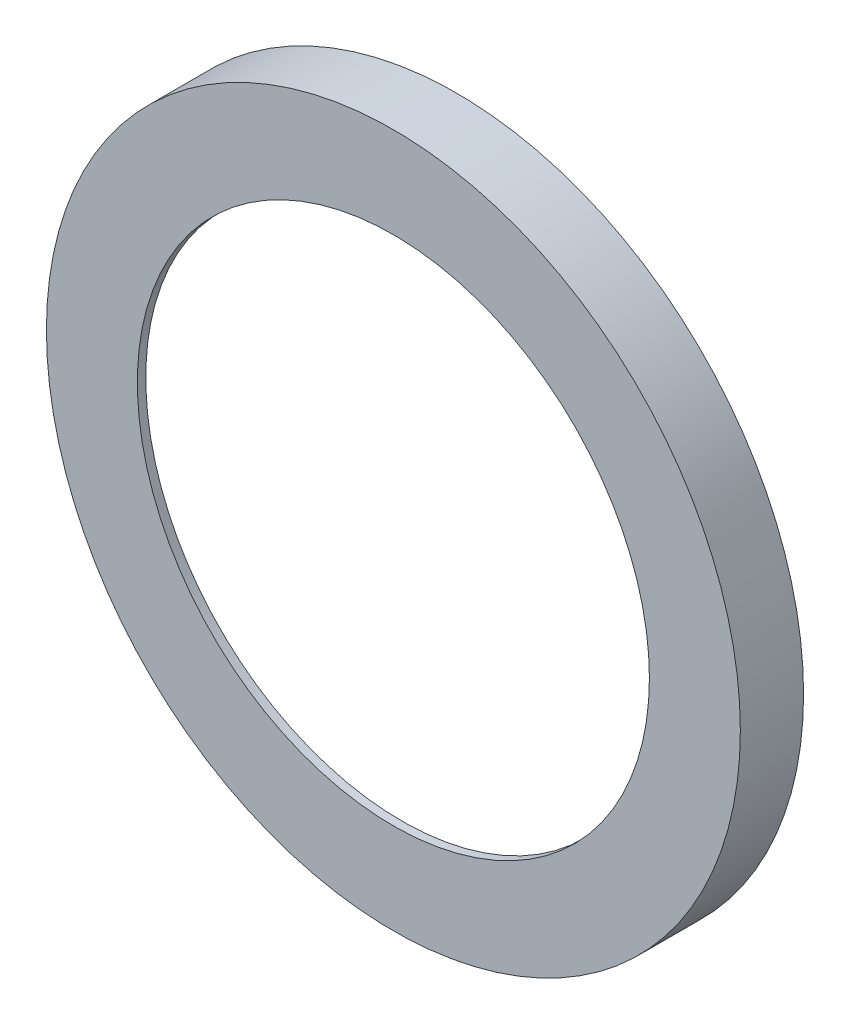
from build123d import *


with BuildPart() as part:
    # Sketch1 → Revolve1 (revolve)
    with BuildSketch(Plane(origin=(0, 0, 0), x_dir=(1, 0, 0), z_dir=(0, 1, 0))):
        Polygon((77.122050956, 2.522185059), (77.122050956, 5.062185059), (100.700774547, 21.572185059), (104.510774547, 21.572185059), (104.510774547, 2.522185059), align=None)
    revolve(axis=Axis((0, 0, 0), (0, 0, -1)))


solid = part.part
